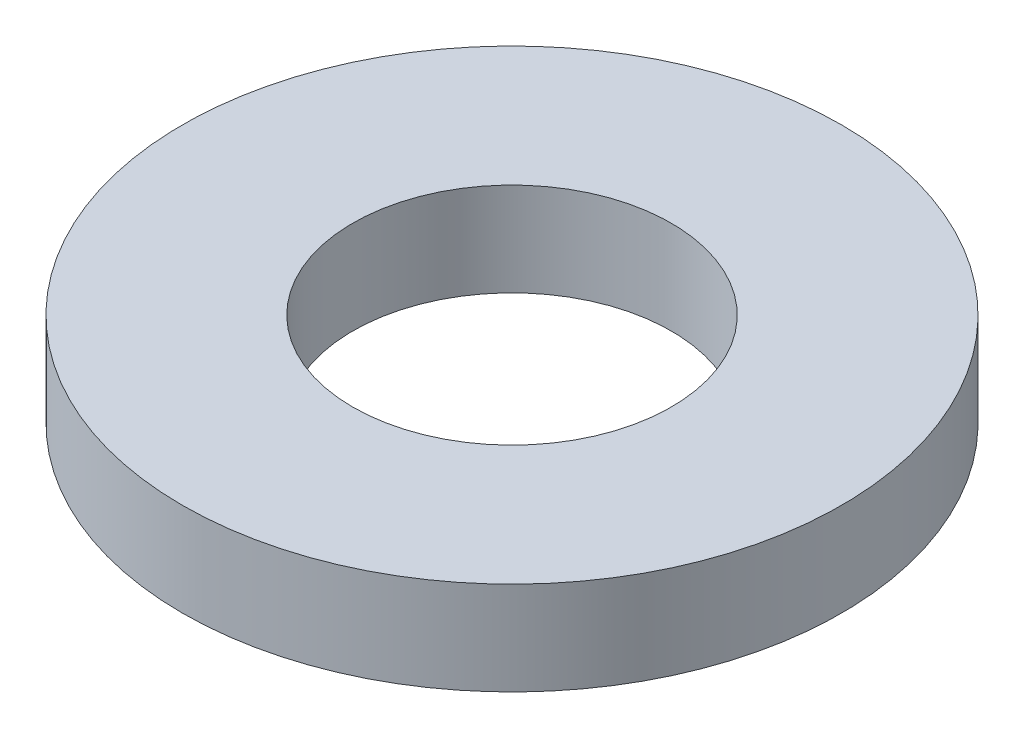
from build123d import *

# Parameters (mm, degrees)
CROQUIS_BASE_R          = 3
CROQUIS_BASE_R_2        = 1.45
SALIENTE_EXTRUIR1_DEPTH = 0.85


with BuildPart() as part:
    # Croquis base → Saliente-Extruir1 (new body)
    with BuildSketch(Plane(origin=(0, 0, 0), x_dir=(1, 0, 0), z_dir=(0, 1, 0))):
        with Locations(Location((0, 0, 0), (0, 0, 270))):
            Circle(CROQUIS_BASE_R)
        with Locations(Location((0, 0, 0), (0, 0, 270))):
            Circle(CROQUIS_BASE_R_2, mode=Mode.SUBTRACT)
    extrude(amount=SALIENTE_EXTRUIR1_DEPTH)


solid = part.part
